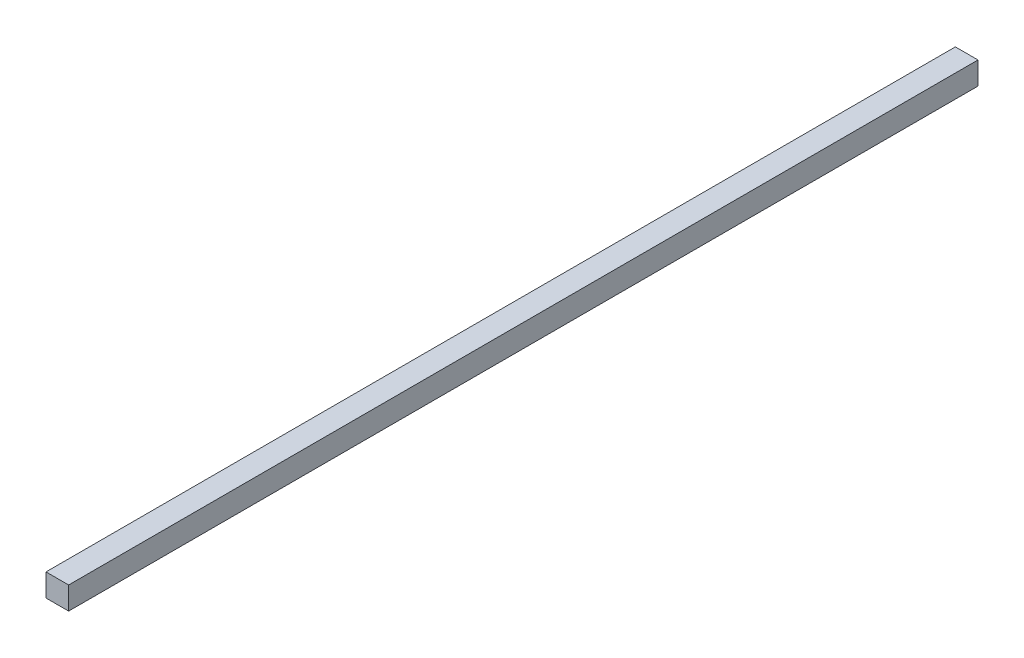
from build123d import *

# Parameters (mm, degrees)
SKETCH3_W           = 6.35
SKETCH3_H           = 6.35
BOSS_EXTRUDE1_DEPTH = 127.5


with BuildPart() as part:
    # Sketch3 → Boss-Extrude1 (new, symmetric)
    with BuildSketch(Plane.XY):
        Rectangle(SKETCH3_W, SKETCH3_H)
    extrude(amount=BOSS_EXTRUDE1_DEPTH, both=True)


solid = part.part
